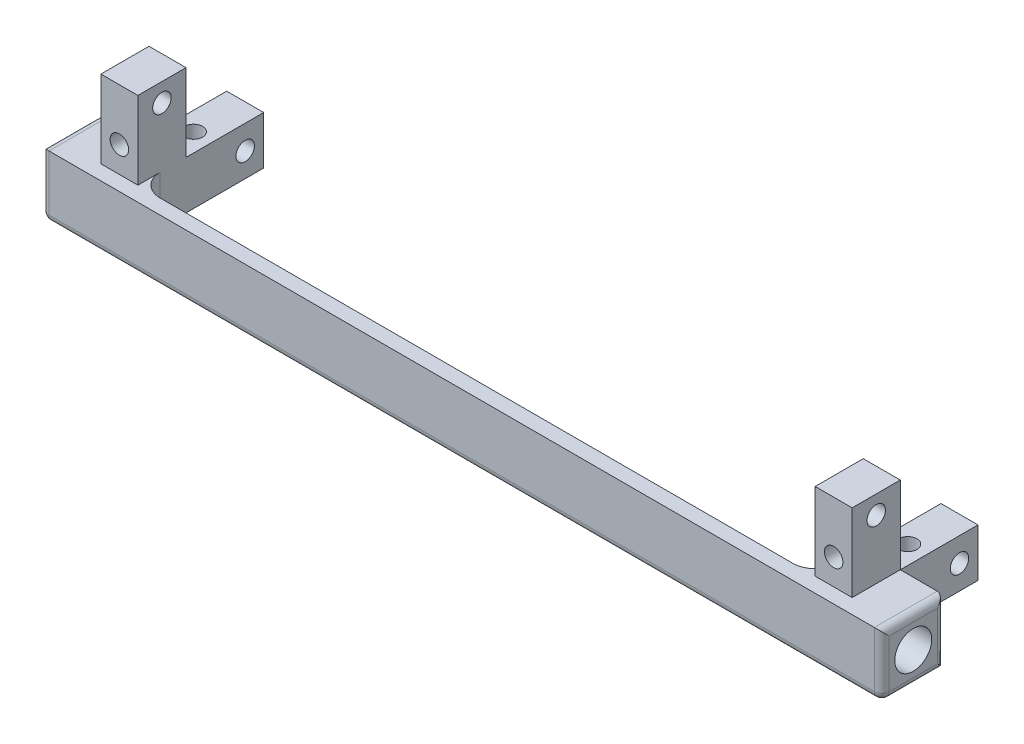
from build123d import *

# Parameters (mm, degrees)
SKETCH1_W                 = 113.5
SKETCH1_H                 = 8.5
BOSS_EXTRUDE1_DEPTH       = 8.5
BOSS_EXTRUDE2_DEPTH       = 5
BOSS_EXTRUDE3_DEPTH       = 5
SKETCH13_W                = 91.5
SKETCH13_H                = 6.5
CUT_EXTRUDE1_DEPTH        = 6.5
M3X0_5_TAPPED_HOLE1_D     = 2.5
M3X0_5_TAPPED_HOLE1_DEPTH = 7.5
M3X0_5_TAPPED_HOLE1_TIP   = 0.751075774
M3X0_5_TAPPED_HOLE2_D     = 2.5
M3X0_5_TAPPED_HOLE2_DEPTH = 5
M3X0_5_TAPPED_HOLE3_D     = 2.5
M3X0_5_TAPPED_HOLE3_DEPTH = 5
M3X0_5_TAPPED_HOLE4_D     = 2.5
M3X0_5_TAPPED_HOLE4_DEPTH = 7.5
M3X0_5_TAPPED_HOLE4_TIP   = 0.751075774
FILLET1_R                 = 1
FILLET2_R                 = 1
FILLET3_R                 = 1
FILLET4_R                 = 3
M3X0_5_TAPPED_HOLE5_D     = 2.5
M3X0_5_TAPPED_HOLE5_DEPTH = 7.5
M3X0_5_TAPPED_HOLE5_TIP   = 0.751075774
M3X0_5_TAPPED_HOLE6_D     = 2.5
M3X0_5_TAPPED_HOLE6_DEPTH = 7.5
M3X0_5_TAPPED_HOLE6_TIP   = 0.751075774
M3X0_5_TAPPED_HOLE7_D     = 2.5
M3X0_5_TAPPED_HOLE7_DEPTH = 7.5
M3X0_5_TAPPED_HOLE7_TIP   = 0.751075774
M3X0_5_TAPPED_HOLE9_D     = 2.5
M3X0_5_TAPPED_HOLE9_DEPTH = 7.5
M3X0_5_TAPPED_HOLE9_TIP   = 0.751075774
SKETCH43_W                = 10.5
SKETCH43_H                = 10.5
CUT_EXTRUDE3_DEPTH        = 110.01404726
SKETCH44_R                = 2.5
CUT_EXTRUDE4_DEPTH        = 10
CUT_EXTRUDE5_REACH        = 107.072
SKETCH45_R                = 1.25
M6_TAPPED_HOLE1_D         = 5
M6_TAPPED_HOLE1_DEPTH     = 3.05
M6_TAPPED_HOLE1_TIP       = 1.502151548


with BuildPart() as part:
    # Sketch1 → Boss-Extrude1 (new body)
    with BuildSketch(Plane.XY):
        Rectangle(SKETCH1_W, SKETCH1_H)
    extrude(amount=BOSS_EXTRUDE1_DEPTH)

    # Sketch4 → Boss-Extrude2 (add)
    with BuildSketch(Plane(origin=(50.75, 0, 0), x_dir=(0, 0, -1), z_dir=(1, 0, 0))):
        Polygon((0, -2.25), (10.5, -2.25), (10.5, 14.75), (-6.5, 14.75), (-6.5, 4.25), (0, 4.25), align=None)
    extrude(amount=-BOSS_EXTRUDE2_DEPTH)

    # Sketch12 → Boss-Extrude3 (add)
    with BuildSketch(Plane.ZY.offset(50.75)):
        Polygon((6.5, 4.25), (6.5, 14.75), (-10.5, 14.75), (-10.5, -2.25), (0, -2.25), (0, 4.25), align=None)
    extrude(amount=-BOSS_EXTRUDE3_DEPTH)

    # Sketch13 → Cut-Extrude1 (cut)
    with BuildSketch(Plane(origin=(0, 4.25, 0), x_dir=(1, 0, 0), z_dir=(0, 1, 0))):
        with Locations((0, -3.25)):
            Rectangle(SKETCH13_W, SKETCH13_H)
    extrude(amount=-CUT_EXTRUDE1_DEPTH, mode=Mode.SUBTRACT)

    # M3x0.5 Tapped Hole1
    with Locations(Plane.XY.offset(6.5)):
        with Locations((-48.25, 7.75)):
            Hole(M3X0_5_TAPPED_HOLE1_D / 2, depth=M3X0_5_TAPPED_HOLE1_DEPTH)
            with Locations((0, 0, -(M3X0_5_TAPPED_HOLE1_DEPTH + M3X0_5_TAPPED_HOLE1_TIP / 2))):  # 118° drill point
                Cone(0, M3X0_5_TAPPED_HOLE1_D / 2, M3X0_5_TAPPED_HOLE1_TIP, mode=Mode.SUBTRACT)

    # M3x0.5 Tapped Hole2
    with Locations(Plane.ZY.offset(50.75)):
        with Locations((3.25, 12.25)):
            Hole(M3X0_5_TAPPED_HOLE2_D / 2, depth=M3X0_5_TAPPED_HOLE2_DEPTH)

    # M3x0.5 Tapped Hole3
    with Locations(Plane.ZY.offset(50.75)):
        with Locations((-8, 1)):
            Hole(M3X0_5_TAPPED_HOLE3_D / 2, depth=M3X0_5_TAPPED_HOLE3_DEPTH)

    # M3x0.5 Tapped Hole4
    with Locations(Plane.XZ.offset(2.25)):
        with Locations((-48.25, -3.5)):
            Hole(M3X0_5_TAPPED_HOLE4_D / 2, depth=M3X0_5_TAPPED_HOLE4_DEPTH)
            with Locations((0, 0, -(M3X0_5_TAPPED_HOLE4_DEPTH + M3X0_5_TAPPED_HOLE4_TIP / 2))):  # 118° drill point
                Cone(0, M3X0_5_TAPPED_HOLE4_D / 2, M3X0_5_TAPPED_HOLE4_TIP, mode=Mode.SUBTRACT)

    # Fillet1
    fillet1_edges = [part.edges().sort_by_distance(p)[0] for p in [
        (0, -4.25, 8.5),
    ]]
    fillet(fillet1_edges, radius=FILLET1_R)

    # Fillet2
    fillet2_edges = [part.edges().sort_by_distance(p)[0] for p in [
        (-56.75, 0.5, 8.5),
        (-56.75, 0, 0),
        (-56.75, 4.25, 4.25),
        (-56.75, -4.25, 3.75),
        (-56.75, -3.957106781, 8.207106781),
    ]]
    fillet(fillet2_edges, radius=FILLET2_R)

    # Fillet3
    fillet3_edges = [part.edges().sort_by_distance(p)[0] for p in [
        (56.75, 0, 0),
        (56.75, 4.25, 4.25),
        (56.75, 0.5, 8.5),
        (56.75, -4.25, 3.75),
        (56.75, -3.957106781, 8.207106781),
    ]]
    fillet(fillet3_edges, radius=FILLET3_R)

    # Fillet4
    fillet4_edges = [part.edges().sort_by_distance(p)[0] for p in [
        (-45.75, 1, 6.5),
        (45.75, 1, 6.5),
    ]]
    fillet(fillet4_edges, radius=FILLET4_R)

    # M3x0.5 Tapped Hole5
    with Locations(Plane.XY.offset(6.5)):
        with Locations((48.25, 7.75)):
            Hole(M3X0_5_TAPPED_HOLE5_D / 2, depth=M3X0_5_TAPPED_HOLE5_DEPTH)
            with Locations((0, 0, -(M3X0_5_TAPPED_HOLE5_DEPTH + M3X0_5_TAPPED_HOLE5_TIP / 2))):  # 118° drill point
                Cone(0, M3X0_5_TAPPED_HOLE5_D / 2, M3X0_5_TAPPED_HOLE5_TIP, mode=Mode.SUBTRACT)

    # M3x0.5 Tapped Hole6
    with Locations(Plane.XZ.offset(2.25)):
        with Locations((48.25, -3.5)):
            Hole(M3X0_5_TAPPED_HOLE6_D / 2, depth=M3X0_5_TAPPED_HOLE6_DEPTH)
            with Locations((0, 0, -(M3X0_5_TAPPED_HOLE6_DEPTH + M3X0_5_TAPPED_HOLE6_TIP / 2))):  # 118° drill point
                Cone(0, M3X0_5_TAPPED_HOLE6_D / 2, M3X0_5_TAPPED_HOLE6_TIP, mode=Mode.SUBTRACT)

    # M3x0.5 Tapped Hole7
    with Locations(Plane(origin=(50.75, 0, 0), x_dir=(0, 0, -1), z_dir=(1, 0, 0))):
        with Locations((8, 1)):
            Hole(M3X0_5_TAPPED_HOLE7_D / 2, depth=M3X0_5_TAPPED_HOLE7_DEPTH)
            with Locations((0, 0, -(M3X0_5_TAPPED_HOLE7_DEPTH + M3X0_5_TAPPED_HOLE7_TIP / 2))):  # 118° drill point
                Cone(0, M3X0_5_TAPPED_HOLE7_D / 2, M3X0_5_TAPPED_HOLE7_TIP, mode=Mode.SUBTRACT)

    # M3x0.5 Tapped Hole9
    with Locations(Plane(origin=(50.75, 0, 0), x_dir=(0, 0, -1), z_dir=(1, 0, 0))):
        with Locations((-3.25, 12.25)):
            Hole(M3X0_5_TAPPED_HOLE9_D / 2, depth=M3X0_5_TAPPED_HOLE9_DEPTH)
            with Locations((0, 0, -(M3X0_5_TAPPED_HOLE9_DEPTH + M3X0_5_TAPPED_HOLE9_TIP / 2))):  # 118° drill point
                Cone(0, M3X0_5_TAPPED_HOLE9_D / 2, M3X0_5_TAPPED_HOLE9_TIP, mode=Mode.SUBTRACT)

    # Sketch43 → Cut-Extrude3 (cut, through all)
    with BuildSketch(Plane.ZY.offset(50.75)):
        with Locations((-5.25, 9.5)):
            Rectangle(SKETCH43_W, SKETCH43_H)
    extrude(amount=-CUT_EXTRUDE3_DEPTH, mode=Mode.SUBTRACT)

    # Sketch44 → Cut-Extrude4 (cut)
    with BuildSketch(Plane(origin=(56.75, 0, 0), x_dir=(0, 0, -1), z_dir=(1, 0, 0))):
        with Locations((-4.25, 0)):
            Circle(SKETCH44_R)
    extrude(amount=-CUT_EXTRUDE4_DEPTH, mode=Mode.SUBTRACT)

    # Sketch45 → Cut-Extrude5 (cut, up to next)
    with BuildSketch(Plane(origin=(46.75, 0, 0), x_dir=(0, 0, -1), z_dir=(1, 0, 0)), mode=Mode.PRIVATE) as cut_extrude5_sk1:
        with Locations((-4.25, 0)):
            Circle(SKETCH45_R)
    cut_extrude5_tool1 = extrude(cut_extrude5_sk1.sketch, amount=-CUT_EXTRUDE5_REACH, mode=Mode.PRIVATE) & part.part
    add(cut_extrude5_tool1.solids().sort_by_distance((46.75, 0, 4.25))[0], mode=Mode.SUBTRACT)

    # M6 Tapped Hole1
    with Locations(Plane(origin=(56.75, 0, 0), x_dir=(0, 0, -1), z_dir=(1, 0, 0))):
        with Locations((-4.25, 0)):
            Hole(M6_TAPPED_HOLE1_D / 2, depth=M6_TAPPED_HOLE1_DEPTH)
            with Locations((0, 0, -(M6_TAPPED_HOLE1_DEPTH + M6_TAPPED_HOLE1_TIP / 2))):  # 118° drill point
                Cone(0, M6_TAPPED_HOLE1_D / 2, M6_TAPPED_HOLE1_TIP, mode=Mode.SUBTRACT)


solid = part.part
